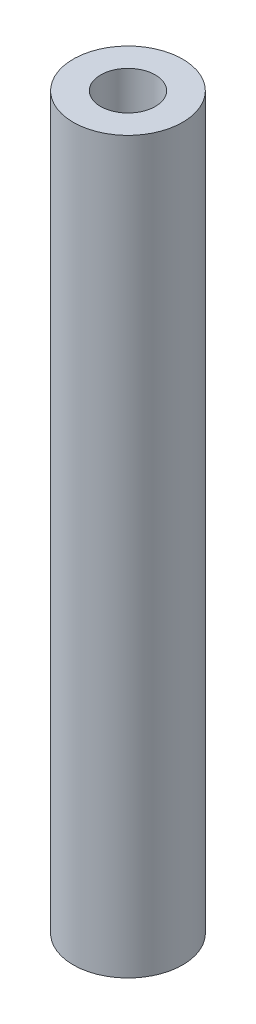
from build123d import *

# Parameters (mm, degrees)
SKETCH1_R           = 3
SKETCH1_R_2         = 1.5
BOSS_EXTRUDE1_DEPTH = 40


with BuildPart() as part:
    # Sketch1 → Boss-Extrude1 (new body)
    with BuildSketch(Plane(origin=(0, 0, 0), x_dir=(1, 0, 0), z_dir=(0, 1, 0))):
        with Locations(Location((0, 0, 0), (0, 0, 270))):
            Circle(SKETCH1_R)
        with Locations(Location((0, 0, 0), (0, 0, 270))):
            Circle(SKETCH1_R_2, mode=Mode.SUBTRACT)
    extrude(amount=BOSS_EXTRUDE1_DEPTH)


solid = part.part
